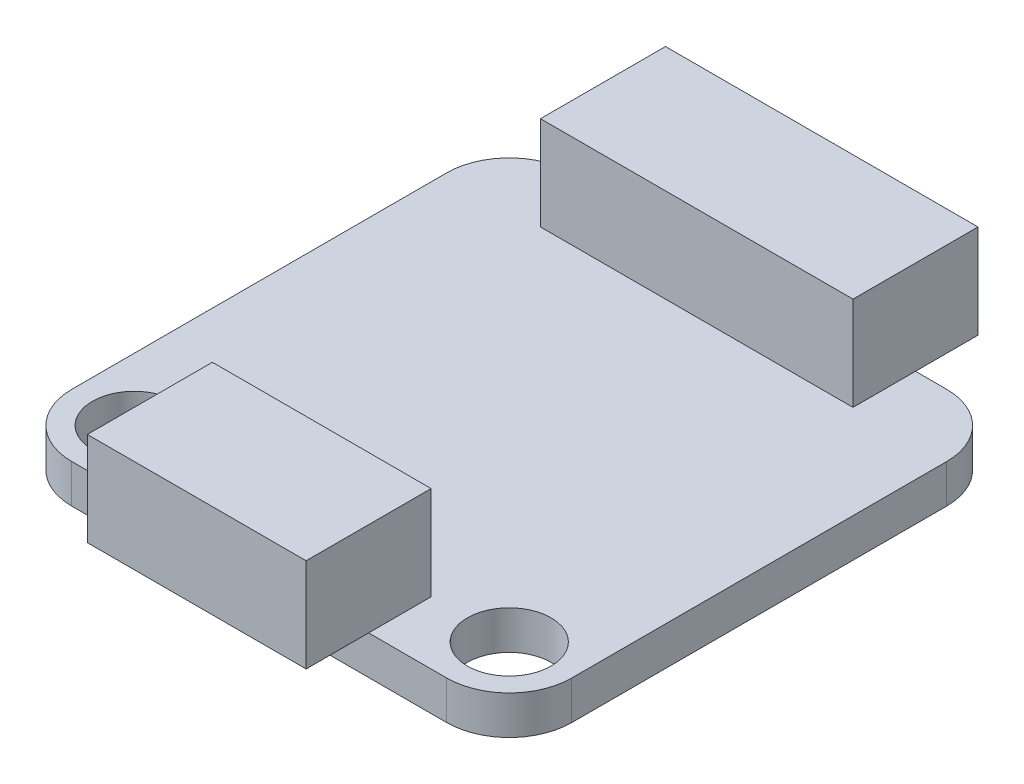
from build123d import *

# Parameters (mm, degrees)
SKETCH1_W             = 20.32
SKETCH1_H             = 20.32
BOSS_EXTRUDE1_DEPTH   = 1.57
FILLET1_R             = 2.54
M3_CLEARANCE_HOLE1_D  = 3.4
SKETCH4_W             = 8.89
SKETCH4_H             = 5.08
BOSS_EXTRUDE2_DEPTH   = 3.81
SKETCH4_W_2           = 12.7
BOSS_EXTRUDE2_2_DEPTH = 3.81


with BuildPart() as part:
    # Sketch1 → Boss-Extrude1 (new body)
    with BuildSketch(Plane(origin=(0, 0, 0), x_dir=(1, 0, 0), z_dir=(0, 1, 0))):
        Rectangle(SKETCH1_W, SKETCH1_H)
    extrude(amount=BOSS_EXTRUDE1_DEPTH)

    # Fillet1
    fillet1_edges = [part.edges().sort_by_distance(p)[0] for p in [
        (10.16, 0.785, 10.16),
        (-10.16, 0.785, 10.16),
        (-10.16, 0.785, -10.16),
        (10.16, 0.785, -10.16),
    ]]
    fillet(fillet1_edges, radius=FILLET1_R)

    # M3 Clearance Hole1 (through all)
    with Locations(Plane(origin=(0, 1.57, 0), x_dir=(1, 0, 0), z_dir=(0, 1, 0))):
        with Locations((-7.62, -7.62), (7.62, -7.62)):
            Hole(M3_CLEARANCE_HOLE1_D / 2)


with BuildPart() as body_2:
    # Sketch4 → Boss-Extrude2 (new body)
    with BuildSketch(Plane(origin=(0, 1.57, 0), x_dir=(1, 0, 0), z_dir=(0, 1, 0))):
        with Locations((0, -10.16)):
            Rectangle(SKETCH4_W, SKETCH4_H)
    extrude(amount=BOSS_EXTRUDE2_DEPTH)


with BuildPart() as body_3:
    # Sketch4 → Boss-Extrude2 2 (new body)
    with BuildSketch(Plane(origin=(0, 1.57, 0), x_dir=(1, 0, 0), z_dir=(0, 1, 0))):
        with Locations((0, 10.16)):
            Rectangle(SKETCH4_W_2, SKETCH4_H)
    extrude(amount=BOSS_EXTRUDE2_2_DEPTH)


solid = Compound([part.part, body_2.part, body_3.part])
